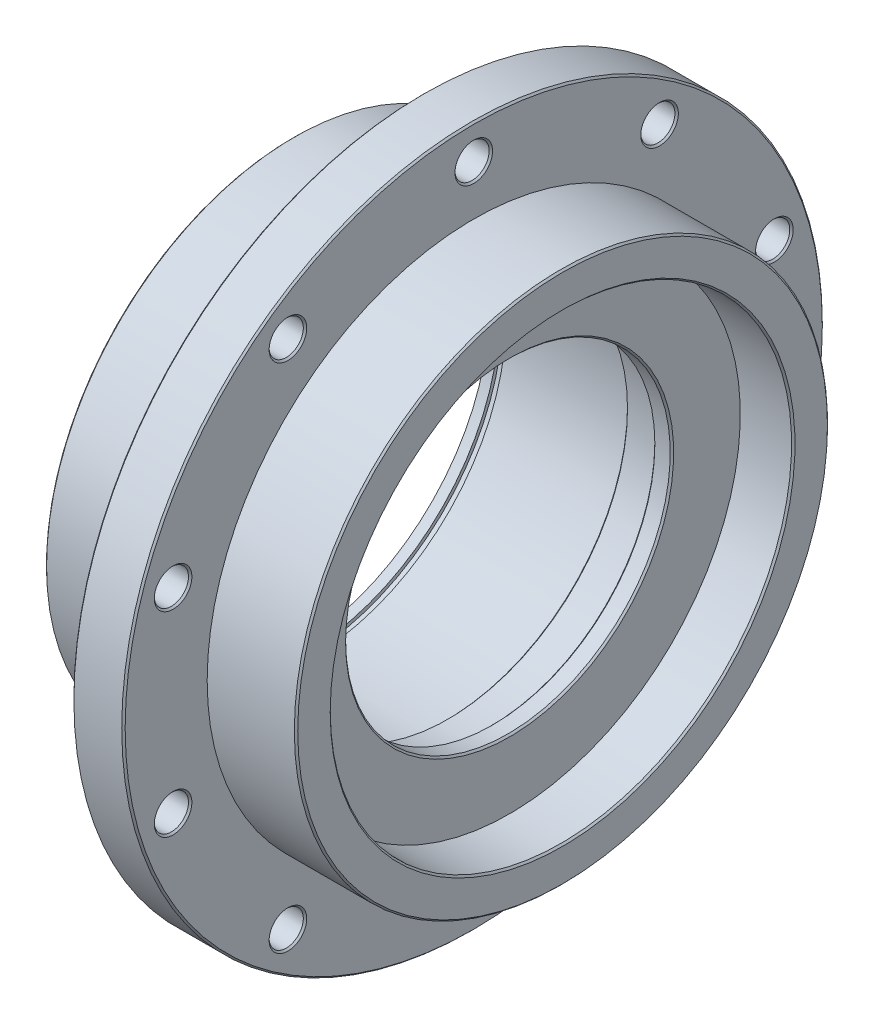
from build123d import *

# Parameters (mm, degrees)
SKETCH_3_R               = 5
CUT_EXTRUDE_2_DEPTH      = 151.643619181
PATTERN_CIRCULAR_1_COUNT = 4
CHAMFER_1_SIZE           = 0.5
CHAMFER_2_SIZE           = 0.5


with BuildPart() as part:
    # 草图1 → 旋转1 (revolve)
    with BuildSketch(Plane.XY, mode=Mode.PRIVATE) as revolve_1_sk:
        Polygon((0, 57.5), (0, 72.5), (38, 72.5), (38, 102.5), (53, 102.5), (53, 78), (79, 78), (79, 67.5), (63.5, 67.5), (63.5, 47.5), (58, 47.5), (58, 52.5), (45, 52.5), (45, 57.5), (5, 57.5), (5, 58.5), (3, 58.5), (3, 57.5), align=None)
    revolve(revolve_1_sk.sketch.rotate(Axis((0, 0, 0), (1, 0, 0)), 90), axis=Axis((0, 0, 0), (1, 0, 0)))

    # 草图3 → 切除-拉伸2 (cut, through all)
    with BuildSketch(Plane.ZY.offset(-38)):
        with Locations((0, 92.5)):
            Circle(SKETCH_3_R)
        with Locations((54.370135837, 74.83407198)):
            Circle(SKETCH_3_R)
        with Locations((87.972727757, 28.58407198)):
            Circle(SKETCH_3_R)
        with Locations((87.972727757, -28.58407198)):
            Circle(SKETCH_3_R)
        with Locations((54.370135837, -74.83407198)):
            Circle(SKETCH_3_R)
        with Locations((0, -92.5)):
            Circle(SKETCH_3_R)
        with Locations((-54.370135837, -74.83407198)):
            Circle(SKETCH_3_R)
        with Locations((-87.972727757, -28.58407198)):
            Circle(SKETCH_3_R)
        with Locations((-87.972727757, 28.58407198)):
            Circle(SKETCH_3_R)
        with Locations((-54.370135837, 74.83407198)):
            Circle(SKETCH_3_R)
    extrude(amount=-CUT_EXTRUDE_2_DEPTH, mode=Mode.SUBTRACT)

    # 草图5 → Ø5.0 (5) 直径孔1 (revolve, cut)
    with BuildSketch(Plane.ZX.offset(65)):
        Polygon((0, 0), (0, 16.502151548), (2.5, 15), (2.5, 0), align=None)
    hole_wizard_5_0_5_1 = revolve(axis=Axis((-6.35, 65, 0), (1, 0, 0)), mode=Mode.SUBTRACT)

    # 阵列(圆周)1: Ø5.0 (5) 直径孔1 ×4 about axis
    pattern_circular_1_axis = Axis((0, 0, 0), (1, 0, 0))
    for i in range(1, PATTERN_CIRCULAR_1_COUNT):
        add(hole_wizard_5_0_5_1.rotate(pattern_circular_1_axis, i * 360 / PATTERN_CIRCULAR_1_COUNT), mode=Mode.SUBTRACT)

    # 倒角1
    chamfer_1_edges = [part.edges().sort_by_distance(p)[0] for p in [
        (38, 0, -102.5),
        (53, 0, -102.5),
        (79, 0, -78),
        (79, 0, -67.5),
        (63.5, 0, -47.5),
        (58, 0, -47.5),
        (45, 0, -52.5),
        (0, 0, -72.5),
    ]]
    chamfer(chamfer_1_edges, length=CHAMFER_1_SIZE)

    # 倒角2
    chamfer_2_edges = [part.edges().sort_by_distance(p)[0] for p in [
        (0, -2.5, -65),
        (53, 92.5, -5),
        (38, 92.5, -5),
        (53, 74.83407198, -59.370135837),
        (38, 74.83407198, -59.370135837),
        (53, 28.58407198, -92.972727757),
        (38, 28.58407198, -92.972727757),
        (53, -28.58407198, -92.972727757),
        (38, -28.58407198, -92.972727757),
        (53, -74.83407198, -59.370135837),
        (38, -74.83407198, -59.370135837),
        (53, -92.5, -5),
        (38, -92.5, -5),
        (53, -74.83407198, 49.370135837),
        (38, -74.83407198, 49.370135837),
        (53, -28.58407198, 82.972727757),
        (38, -28.58407198, 82.972727757),
        (53, 28.58407198, 82.972727757),
        (38, 28.58407198, 82.972727757),
        (53, 74.83407198, 49.370135837),
        (38, 74.83407198, 49.370135837),
        (0, 65, -2.5),
        (0, 2.5, 65),
        (0, -65, 2.5),
    ]]
    chamfer(chamfer_2_edges, length=CHAMFER_2_SIZE)


solid = part.part
